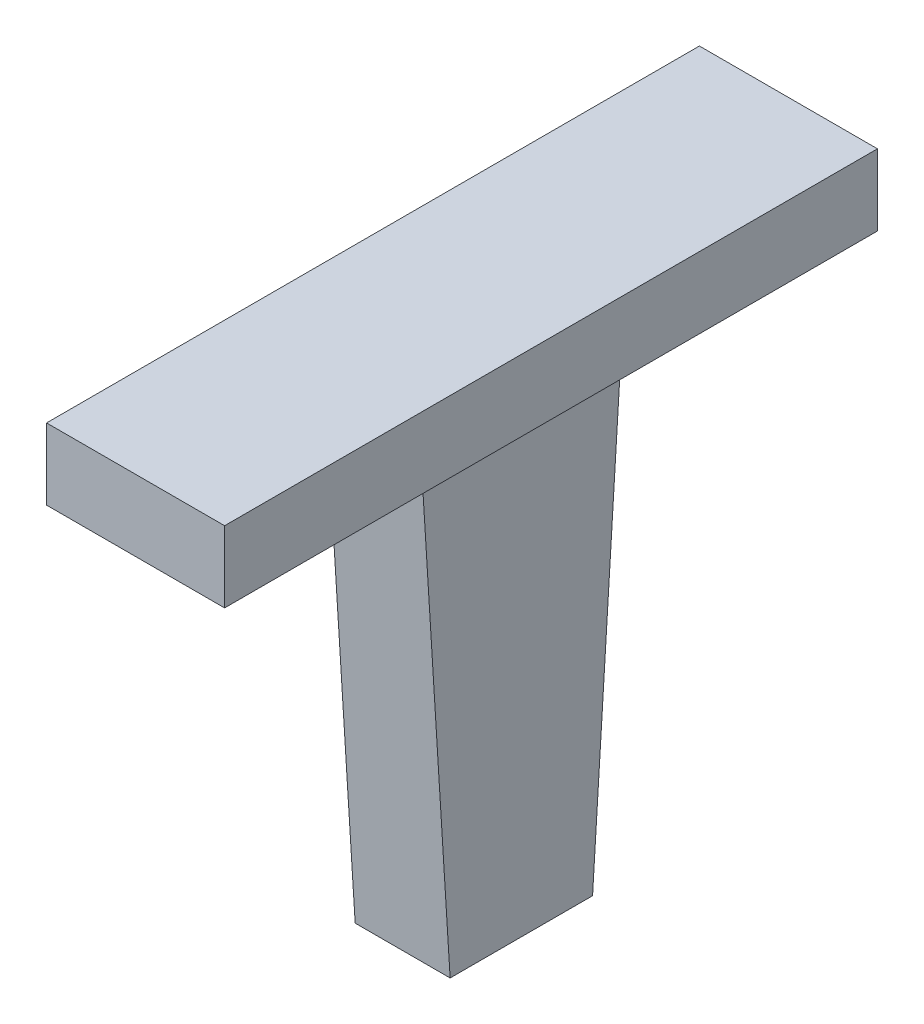
from build123d import *

# Parameters (mm, degrees)
BOSS_EXTRUDE1_DEPTH = 40
BOSS_EXTRUDE2_START = -17.5
SKETCH2_W           = 275
SKETCH2_H           = 30
BOSS_EXTRUDE2_DEPTH = 75
SKETCH4_R           = 3.5
CUT_EXTRUDE1_DEPTH  = 10


with BuildPart() as part:
    # Sketch1 → Boss-Extrude1 (new body)
    with BuildSketch(Plane(origin=(0, 0, 0), x_dir=(0, 0, -1), z_dir=(1, 0, 0))):
        Polygon((-30, 0), (30, 0), (42.5, 200), (132.5, 200), (132.5, 230), (-142.5, 230), (-142.5, 200), (-42.5, 200), align=None)
    extrude(amount=BOSS_EXTRUDE1_DEPTH)

    # Sketch2 → Boss-Extrude2 (add)
    with BuildSketch(Plane(origin=(0, 0, 0), x_dir=(0, 0, -1), z_dir=(1, 0, 0)).offset(BOSS_EXTRUDE2_START)):
        with Locations((-5, 215)):
            Rectangle(SKETCH2_W, SKETCH2_H)
    extrude(amount=BOSS_EXTRUDE2_DEPTH)

    # Sketch4 → Cut-Extrude1 (cut)
    with BuildSketch(Plane(origin=(0, 0, 0), x_dir=(1, 0, 0), z_dir=(0, 1, 0))):
        with Locations(Location((20, -10, 0), (0, 0, 270))):
            Circle(SKETCH4_R)
        with Locations(Location((20, 10, 0), (0, 0, 270))):
            Circle(SKETCH4_R)
    extrude(amount=CUT_EXTRUDE1_DEPTH, mode=Mode.SUBTRACT)


solid = part.part
